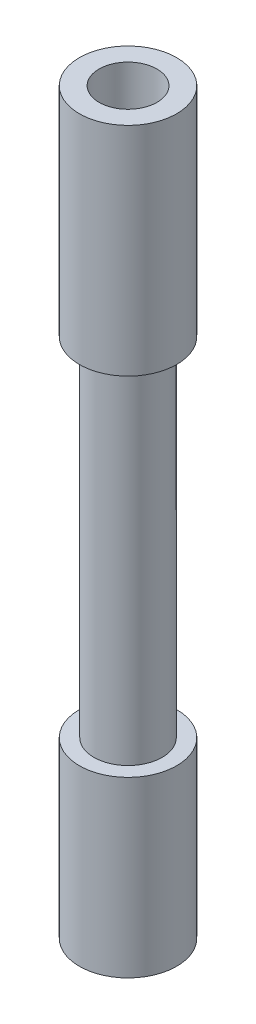
from build123d import *

# Parameters (mm, degrees)
SKETCH2_R           = 5.334
SKETCH2_R_2         = 2
BOSS_EXTRUDE1_DEPTH = 61.9125
CUT_EXTRUDE1_START  = -19.05
SKETCH3_R           = 5.334
SKETCH3_R_2         = 3.7465
CUT_EXTRUDE1_DEPTH  = 38.1


with BuildPart() as part:
    # Sketch1 → Revolve1 (revolve)
    with BuildSketch(Plane.XY, mode=Mode.PRIVATE) as revolve1_sk:
        Polygon((2, 0), (3.175, 0), (3.175, 9.525), (5.334, 9.525), (5.334, -9.525), (2, -9.525), align=None)
    revolve(revolve1_sk.sketch.rotate(Axis((0, 0, 0), (0, 1, 0)), 90), axis=Axis((0, 0, 0), (0, 1, 0)))

    # Sketch2 → Boss-Extrude1 (add)
    with BuildSketch(Plane.XZ.offset(9.525)):
        with Locations(Location((0, 0, 0), (0, 0, 270))):
            Circle(SKETCH2_R)
        with Locations(Location((0, 0, 0), (0, 0, 270))):
            Circle(SKETCH2_R_2, mode=Mode.SUBTRACT)
    extrude(amount=BOSS_EXTRUDE1_DEPTH)

    # Sketch3 → Cut-Extrude1 (cut)
    with BuildSketch(Plane.XZ.offset(71.4375).offset(CUT_EXTRUDE1_START)):
        with Locations(Location((0, 0, 0), (0, 0, 270))):
            Circle(SKETCH3_R)
        with Locations(Location((0, 0, 0), (0, 0, 270))):
            Circle(SKETCH3_R_2, mode=Mode.SUBTRACT)
    extrude(amount=-CUT_EXTRUDE1_DEPTH, mode=Mode.SUBTRACT)


solid = part.part
